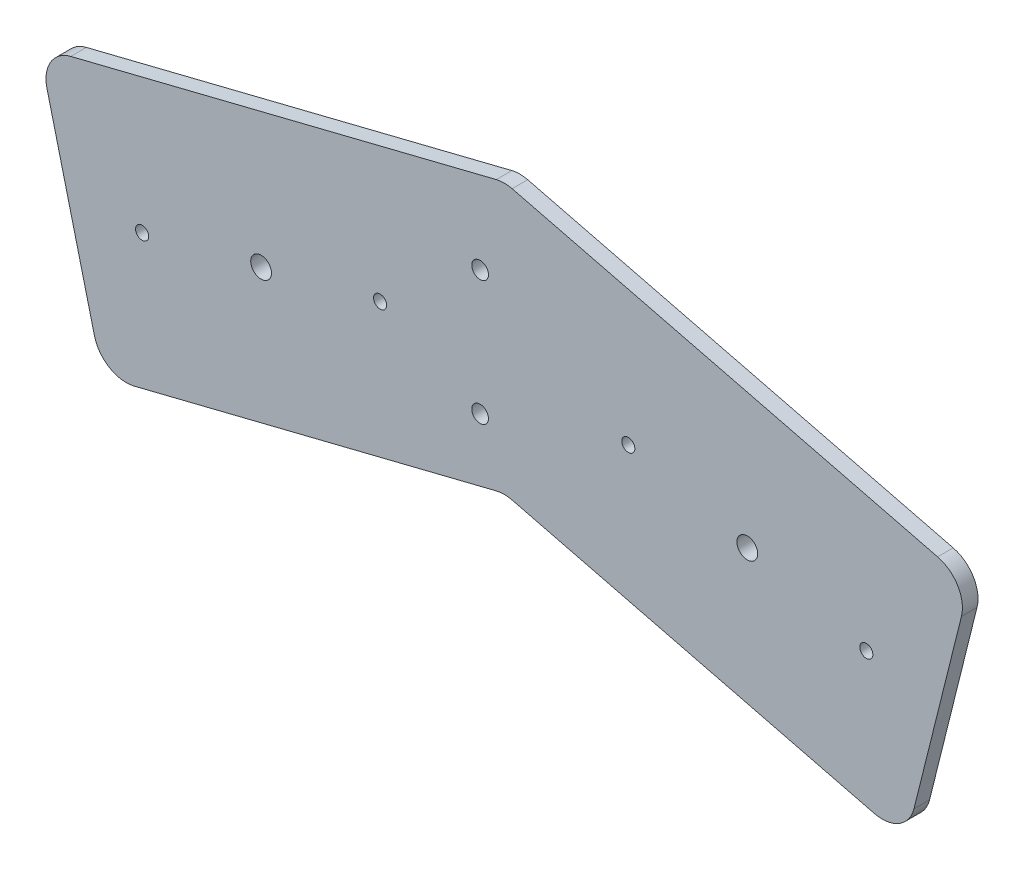
from build123d import *

# Parameters (mm, degrees)
BOSS_EXTRUDE1_DEPTH         = 4.7625
F_1_4_0_25_DIAMETER_HOLE2_D = 6.35
F_4_0MM_DOWEL_HOLE1_D       = 4
F_1_4_20_TAPPED_HOLE1_D     = 5.1054


with BuildPart() as part:
    # Sketch1 → Boss-Extrude1 (new body)
    with BuildSketch(Plane.XY):
        with BuildLine():
            Line((-132.526798161, -26.601306725), (-2.419218956, 5.838156153))
            ThreePointArc((-2.419218956, 5.838156153), (0, 6.13519889), (2.419218956, 5.838156153))
            Line((2.419218956, 5.838156153), (132.526798161, -26.601306725))
            ThreePointArc((132.526798161, -26.601306725), (138.679252212, -31.153883239), (139.810536468, -38.723482944))
            Line((139.810536468, -38.723482944), (125.295222732, -96.941226521))
            ThreePointArc((125.295222732, -96.941226521), (120.742646218, -103.093680572), (113.173046513, -104.224964827))
            Line((113.173046513, -104.224964827), (2.419218956, -76.610934195))
            ThreePointArc((2.419218956, -76.610934195), (0, -76.313891458), (-2.419218956, -76.610934195))
            Line((-2.419218956, -76.610934195), (-113.173046513, -104.224964827))
            ThreePointArc((-113.173046513, -104.224964827), (-120.742646218, -103.093680572), (-125.295222732, -96.941226521))
            Line((-125.295222732, -96.941226521), (-139.810536468, -38.723482944))
            ThreePointArc((-139.810536468, -38.723482944), (-138.679252212, -31.153883239), (-132.526798161, -26.601306725))
        make_face()
    extrude(amount=-BOSS_EXTRUDE1_DEPTH)

    # 1/4 (0.25) Diameter Hole2 (through all)
    with Locations(Plane.XY):
        with Locations((-74.335136024, -53.317040996), (74.335136024, -53.317040996)):
            Hole(F_1_4_0_25_DIAMETER_HOLE2_D / 2)

    # Ø4.0mm Dowel Hole1 (through all)
    with Locations(Plane.XY):
        with Locations((-110.721225759, -62.389112081), (-37.949046288, -44.244969911), (37.949046288, -44.244969911), (110.721225759, -62.389112081)):
            Hole(F_4_0MM_DOWEL_HOLE1_D / 2)

    # 1/4-20 Tapped Hole1 (through all)
    with Locations(Plane.XY):
        with Locations((-7.366, -20.569560235), (-7.366, -58.669560235)):
            Hole(F_1_4_20_TAPPED_HOLE1_D / 2)


solid = part.part
